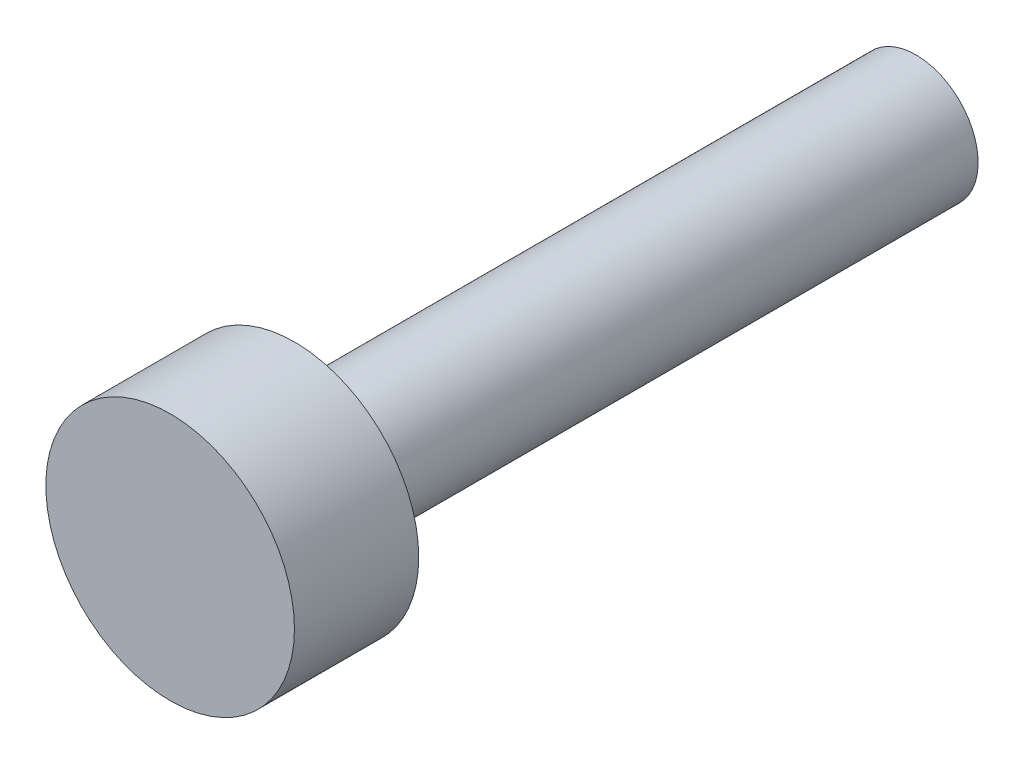
from build123d import *

# Parameters (mm, degrees)
SKETCH1_R           = 1.5875
BOSS_EXTRUDE1_DEPTH = 19.05
SKETCH2_R           = 3.175
BOSS_EXTRUDE2_DEPTH = 3.175


with BuildPart() as part:
    # Sketch1 → Boss-Extrude1 (new body)
    with BuildSketch(Plane.XY):
        with Locations(Location((0, 0, 0), (0, 0, 180))):
            Circle(SKETCH1_R)
    extrude(amount=BOSS_EXTRUDE1_DEPTH)

    # Sketch2 → Boss-Extrude2 (add)
    with BuildSketch(Plane.XY.offset(19.05)):
        Circle(SKETCH2_R)
    extrude(amount=-BOSS_EXTRUDE2_DEPTH)


solid = part.part
